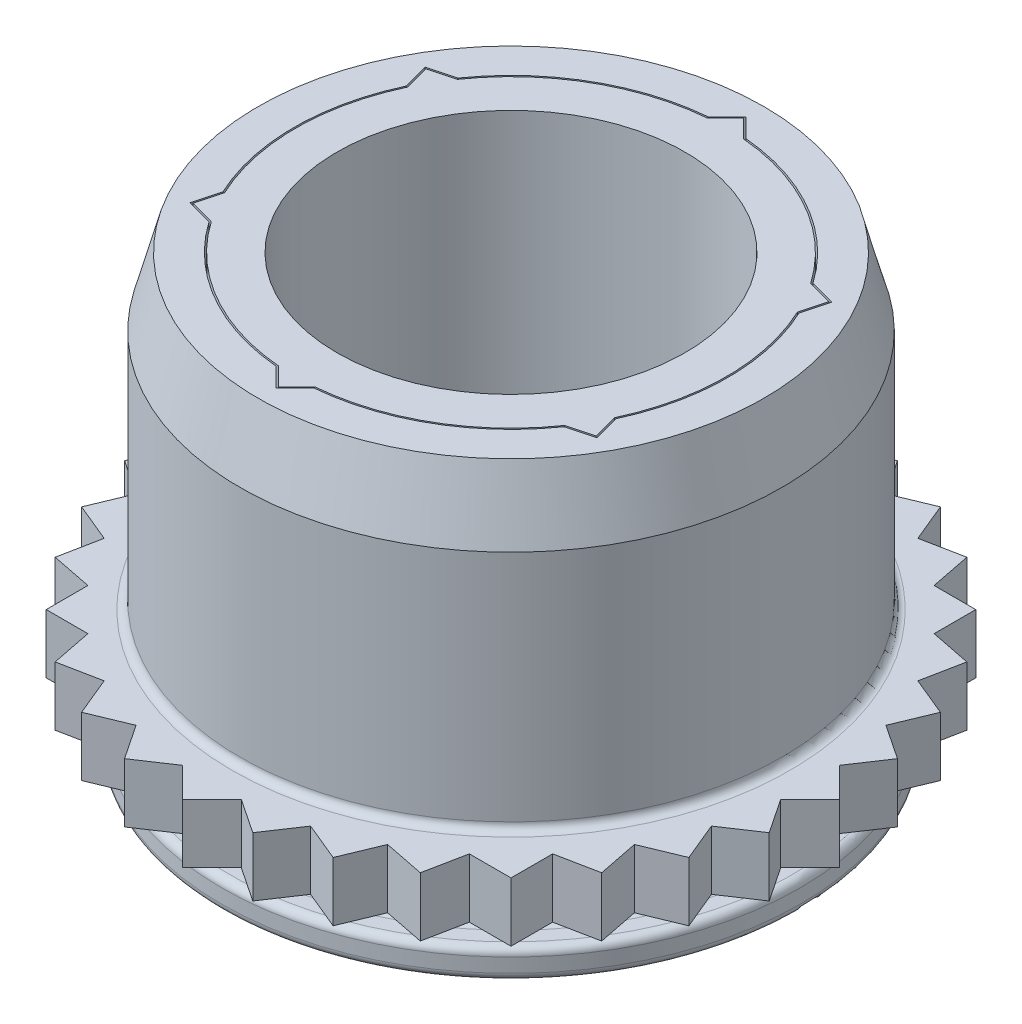
from build123d import *

# Parameters (mm, degrees)
CUT_EXTRUDE3_DEPTH      = 8.219764539
CUT_EXTRUDE3_DEPTH_BACK = 8.219764539
SKETCH5_OUTSIDE_W       = 13.146
SKETCH5_OUTSIDE_H       = 13.146
INSERT_HOLE_CUT_DEPTH   = 3.2
SKETCH4_R               = 2.25
INSERT_EXTRUDE_DEPTH    = 3.2


with BuildPart() as part:
    # Sketch2 → Body Revolve (revolve)
    with BuildSketch(Plane(origin=(0, 0, 0), x_dir=(0, 0, -1), z_dir=(1, 0, 0))):
        with BuildLine():
            Line((2.804, 5.53), (3.269204711, 5.53))
            Line((3.269204711, 5.53), (3.505, 4.65))
            Line((3.505, 4.65), (3.505, 1.63))
            ThreePointArc((3.505, 1.63), (3.534289322, 1.559289322), (3.605, 1.53))
            Line((3.605, 1.53), (4.25, 1.53))
            Line((4.25, 1.53), (4.25, 0.765))
            Line((4.25, 0.765), (3.4575, 0.765))
            ThreePointArc((3.4575, 0.765), (3.386789322, 0.735710678), (3.3575, 0.665))
            Line((3.3575, 0.665), (3.3575, 0.4825))
            ThreePointArc((3.3575, 0.4825), (3.386789322, 0.411789322), (3.4575, 0.3825))
            Line((3.4575, 0.3825), (3.64, 0.3825))
            ThreePointArc((3.64, 0.3825), (3.710710678, 0.353210678), (3.74, 0.2825))
            Line((3.74, 0.2825), (3.74, 0.1))
            ThreePointArc((3.74, 0.1), (3.710710678, 0.029289322), (3.64, 0))
            Line((3.64, 0), (2.433, 0))
            Line((2.433, 0), (2, 0.433))
            Line((2, 0.433), (2, 1.897))
            Line((2, 1.897), (2.433, 2.33))
            Line((2.433, 2.33), (2.804, 2.33))
            Line((2.804, 2.33), (2.804, 5.53))
        make_face()
    revolve(axis=Axis((0, 0, 0), (0, 1, 0)))

    # Sketch5 outside → Cut-Extrude3 (cut, two sides: drawn at the far end of the back side and taken through both)
    with BuildSketch(Plane(origin=(0, 1.53, 0), x_dir=(1, 0, 0), z_dir=(0, 1, 0)).offset(-CUT_EXTRUDE3_DEPTH_BACK)):
        Rectangle(SKETCH5_OUTSIDE_W, SKETCH5_OUTSIDE_H)
        Polygon((-4.25, 0), (-3.868942431, -0.381057569), (-4.168337442, -0.829133869), (-3.720261143, -1.12852888), (-3.926488013, -1.626404588), (-3.428612305, -1.832631458), (-3.533745852, -2.36117349), (-3.00520382, -2.466307037), (-3.00520382, -3.00520382), (-2.466307037, -3.00520382), (-2.36117349, -3.533745852), (-1.832631458, -3.428612305), (-1.626404588, -3.926488013), (-1.12852888, -3.720261143), (-0.829133869, -4.168337442), (-0.381057569, -3.868942431), (0, -4.25), (0.381057569, -3.868942431), (0.829133869, -4.168337442), (1.12852888, -3.720261143), (1.626404588, -3.926488013), (1.832631458, -3.428612305), (2.36117349, -3.533745852), (2.466307037, -3.00520382), (3.00520382, -3.00520382), (3.00520382, -2.466307037), (3.533745852, -2.36117349), (3.428612305, -1.832631458), (3.926488013, -1.626404588), (3.720261143, -1.12852888), (4.168337442, -0.829133869), (3.868942431, -0.381057569), (4.25, 0), (3.868942431, 0.381057569), (4.168337442, 0.829133869), (3.720261143, 1.12852888), (3.926488013, 1.626404588), (3.428612305, 1.832631458), (3.533745852, 2.36117349), (3.00520382, 2.466307037), (3.00520382, 3.00520382), (2.466307037, 3.00520382), (2.36117349, 3.533745852), (1.832631458, 3.428612305), (1.626404588, 3.926488013), (1.12852888, 3.720261143), (0.829133869, 4.168337442), (0.381057569, 3.868942431), (0, 4.25), (-0.381057569, 3.868942431), (-0.829133869, 4.168337442), (-1.12852888, 3.720261143), (-1.626404588, 3.926488013), (-1.832631458, 3.428612305), (-2.36117349, 3.533745852), (-2.466307037, 3.00520382), (-3.00520382, 3.00520382), (-3.00520382, 2.466307037), (-3.533745852, 2.36117349), (-3.428612305, 1.832631458), (-3.926488013, 1.626404588), (-3.720261143, 1.12852888), (-4.168337442, 0.829133869), (-3.868942431, 0.381057569), align=None, mode=Mode.SUBTRACT)
    extrude(amount=CUT_EXTRUDE3_DEPTH + CUT_EXTRUDE3_DEPTH_BACK, mode=Mode.SUBTRACT)

    # Sketch3 → Insert Hole Cut (cut)
    with BuildSketch(Plane(origin=(0, 5.53, 0), x_dir=(1, 0, 0), z_dir=(0, 1, 0))):
        with BuildLine():
            Line((-0.244332135, 2.793334532), (0, 3.037666667))
            Line((0, 3.037666667), (0.244332135, 2.793334532))
            ThreePointArc((0.244332135, 2.793334532), (1.402, 2.428335232), (2.296932599, 1.608265102))
            Line((2.296932599, 1.608265102), (2.630696502, 1.518833333))
            Line((2.630696502, 1.518833333), (2.541264733, 1.18506943))
            ThreePointArc((2.541264733, 1.18506943), (2.804, 0), (2.541264733, -1.18506943))
            Line((2.541264733, -1.18506943), (2.630696502, -1.518833333))
            Line((2.630696502, -1.518833333), (2.296932599, -1.608265102))
            ThreePointArc((2.296932599, -1.608265102), (1.402, -2.428335232), (0.244332135, -2.793334532))
            Line((0.244332135, -2.793334532), (0, -3.037666667))
            Line((0, -3.037666667), (-0.244332135, -2.793334532))
            ThreePointArc((-0.244332135, -2.793334532), (-1.402, -2.428335232), (-2.296932599, -1.608265102))
            Line((-2.296932599, -1.608265102), (-2.630696502, -1.518833333))
            Line((-2.630696502, -1.518833333), (-2.541264733, -1.18506943))
            ThreePointArc((-2.541264733, -1.18506943), (-2.804, 0), (-2.541264733, 1.18506943))
            Line((-2.541264733, 1.18506943), (-2.630696502, 1.518833333))
            Line((-2.630696502, 1.518833333), (-2.296932599, 1.608265102))
            ThreePointArc((-2.296932599, 1.608265102), (-1.402, 2.428335232), (-0.244332135, 2.793334532))
        make_face()
    extrude(amount=-INSERT_HOLE_CUT_DEPTH, mode=Mode.SUBTRACT)


with BuildPart() as body_2:
    # Sketch4 → Insert Extrude (new body)
    with BuildSketch(Plane(origin=(0, 5.53, 0), x_dir=(1, 0, 0), z_dir=(0, 1, 0))):
        with BuildLine():
            Line((2.606201604, -1.504691198), (2.520058293, -1.183199983))
            ThreePointArc((2.520058293, -1.183199983), (2.784, 0), (2.520058293, 1.183199983))
            Line((2.520058293, 1.183199983), (2.606201604, 1.504691198))
            Line((2.606201604, 1.504691198), (2.28471039, 1.590834509))
            ThreePointArc((2.28471039, 1.590834509), (1.392, 2.411014724), (0.235347903, 2.774034492))
            Line((0.235347903, 2.774034492), (0, 3.009382395))
            Line((0, 3.009382395), (-0.235347903, 2.774034492))
            ThreePointArc((-0.235347903, 2.774034492), (-1.392, 2.411014724), (-2.28471039, 1.590834509))
            Line((-2.28471039, 1.590834509), (-2.606201604, 1.504691198))
            Line((-2.606201604, 1.504691198), (-2.520058293, 1.183199983))
            ThreePointArc((-2.520058293, 1.183199983), (-2.784, 0), (-2.520058293, -1.183199983))
            Line((-2.520058293, -1.183199983), (-2.606201604, -1.504691198))
            Line((-2.606201604, -1.504691198), (-2.28471039, -1.590834509))
            ThreePointArc((-2.28471039, -1.590834509), (-1.392, -2.411014724), (-0.235347903, -2.774034492))
            Line((-0.235347903, -2.774034492), (0, -3.009382395))
            Line((0, -3.009382395), (0.235347903, -2.774034492))
            ThreePointArc((0.235347903, -2.774034492), (1.392, -2.411014724), (2.28471039, -1.590834509))
            Line((2.28471039, -1.590834509), (2.606201604, -1.504691198))
        make_face()
        with Locations(Location((0, 0, 0), (0, 0, 270))):
            Circle(SKETCH4_R, mode=Mode.SUBTRACT)
    extrude(amount=-INSERT_EXTRUDE_DEPTH)


solid = Compound([part.part, body_2.part])
